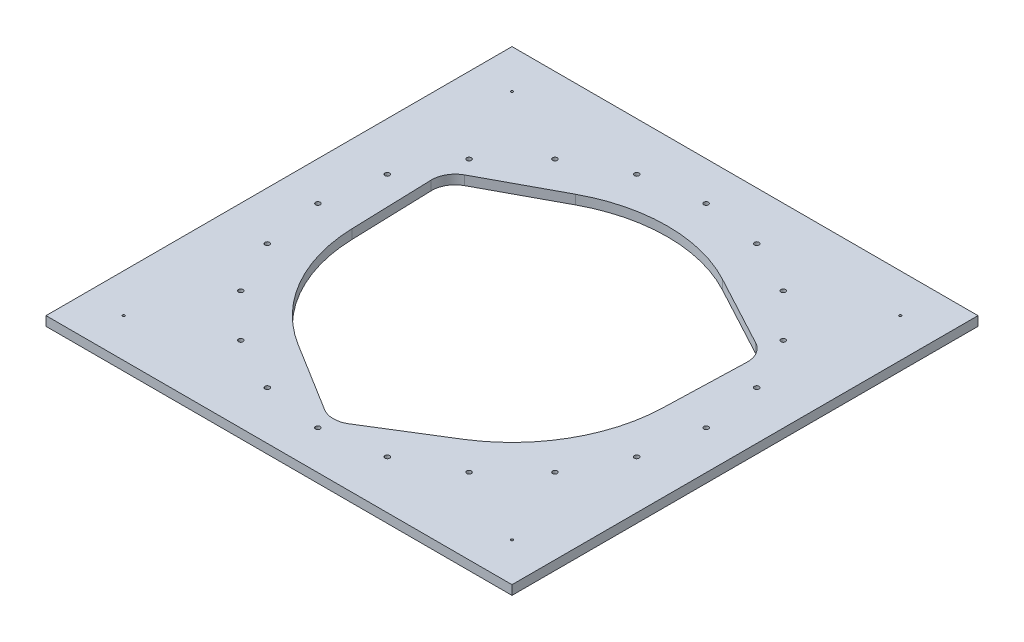
from build123d import *

# Parameters (mm, degrees)
SKETCH1_W           = 600
SKETCH1_H           = 600
SKETCH1_R           = 3
SKETCH1_R_2         = 1.5
BOSS_EXTRUDE1_DEPTH = 12


with BuildPart() as part:
    # Sketch1 → Boss-Extrude1 (new body)
    with BuildSketch(Plane(origin=(0, 0, 0), x_dir=(1, 0, 0), z_dir=(0, 1, 0))):
        Rectangle(SKETCH1_W, SKETCH1_H)
        with Locations(Location((0, 250, 0), (0, 0, 270))):
            Circle(SKETCH1_R, mode=Mode.SUBTRACT)
        with Locations(Location((77.254248594, 237.764129074, 0), (0, 0, 270))):
            Circle(SKETCH1_R, mode=Mode.SUBTRACT)
        with Locations(Location((146.946313073, 202.254248594, 0), (0, 0, 270))):
            Circle(SKETCH1_R, mode=Mode.SUBTRACT)
        with Locations(Location((202.254248594, 146.946313073, 0), (0, 0, 270))):
            Circle(SKETCH1_R, mode=Mode.SUBTRACT)
        with Locations(Location((237.764129074, 77.254248594, 0), (0, 0, 270))):
            Circle(SKETCH1_R, mode=Mode.SUBTRACT)
        with Locations(Location((250, 0, 0), (0, 0, 270))):
            Circle(SKETCH1_R, mode=Mode.SUBTRACT)
        with Locations(Location((237.764129074, -77.254248594, 0), (0, 0, 270))):
            Circle(SKETCH1_R, mode=Mode.SUBTRACT)
        with Locations(Location((202.254248594, -146.946313073, 0), (0, 0, 270))):
            Circle(SKETCH1_R, mode=Mode.SUBTRACT)
        with Locations(Location((146.946313073, -202.254248594, 0), (0, 0, 270))):
            Circle(SKETCH1_R, mode=Mode.SUBTRACT)
        with Locations(Location((77.254248594, -237.764129074, 0), (0, 0, 270))):
            Circle(SKETCH1_R, mode=Mode.SUBTRACT)
        with Locations(Location((0, -250, 0), (0, 0, 270))):
            Circle(SKETCH1_R, mode=Mode.SUBTRACT)
        with Locations(Location((-77.254248594, -237.764129074, 0), (0, 0, 270))):
            Circle(SKETCH1_R, mode=Mode.SUBTRACT)
        with Locations(Location((-146.946313073, -202.254248594, 0), (0, 0, 270))):
            Circle(SKETCH1_R, mode=Mode.SUBTRACT)
        with Locations(Location((-202.254248594, -146.946313073, 0), (0, 0, 270))):
            Circle(SKETCH1_R, mode=Mode.SUBTRACT)
        with Locations(Location((-237.764129074, -77.254248594, 0), (0, 0, 270))):
            Circle(SKETCH1_R, mode=Mode.SUBTRACT)
        with Locations(Location((-250, 0, 0), (0, 0, 270))):
            Circle(SKETCH1_R, mode=Mode.SUBTRACT)
        with Locations(Location((-237.764129074, 77.254248594, 0), (0, 0, 270))):
            Circle(SKETCH1_R, mode=Mode.SUBTRACT)
        with Locations(Location((-202.254248594, 146.946313073, 0), (0, 0, 270))):
            Circle(SKETCH1_R, mode=Mode.SUBTRACT)
        with Locations(Location((-146.946313073, 202.254248594, 0), (0, 0, 270))):
            Circle(SKETCH1_R, mode=Mode.SUBTRACT)
        with Locations(Location((-77.254248594, 237.764129074, 0), (0, 0, 270))):
            Circle(SKETCH1_R, mode=Mode.SUBTRACT)
        with Locations(Location((-250, 250, 0), (0, 0, 270))):
            Circle(SKETCH1_R_2, mode=Mode.SUBTRACT)
        with Locations(Location((250, 250, 0), (0, 0, 270))):
            Circle(SKETCH1_R_2, mode=Mode.SUBTRACT)
        with Locations(Location((250, -250, 0), (0, 0, 270))):
            Circle(SKETCH1_R_2, mode=Mode.SUBTRACT)
        with Locations(Location((-250, -250, 0), (0, 0, 270))):
            Circle(SKETCH1_R_2, mode=Mode.SUBTRACT)
        with BuildLine():
            Line((-203.190468868, 99.063784307), (-199.902587408, -6.241437954))
            ThreePointArc((-199.902587408, -6.241437954), (-173.205080757, -100), (-105.356537529, -170))
            Line((-105.356537529, -170), (-15.803480629, -225.5))
            ThreePointArc((-15.803480629, -225.5), (0, -230), (15.803480629, -225.5))
            Line((15.803480629, -225.5), (105.356537529, -170))
            ThreePointArc((105.356537529, -170), (173.205080757, -100), (199.902587408, -6.241437954))
            Line((199.902587408, -6.241437954), (203.190468868, 99.063784307))
            ThreePointArc((203.190468868, 99.063784307), (199.18584287, 115), (187.386988239, 126.436215693))
            Line((187.386988239, 126.436215693), (94.546049879, 176.241437954))
            ThreePointArc((94.546049879, 176.241437954), (0, 200), (-94.546049879, 176.241437954))
            Line((-94.546049879, 176.241437954), (-187.386988239, 126.436215693))
            ThreePointArc((-187.386988239, 126.436215693), (-199.18584287, 115), (-203.190468868, 99.063784307))
        make_face(mode=Mode.SUBTRACT)
    extrude(amount=BOSS_EXTRUDE1_DEPTH)


solid = part.part
